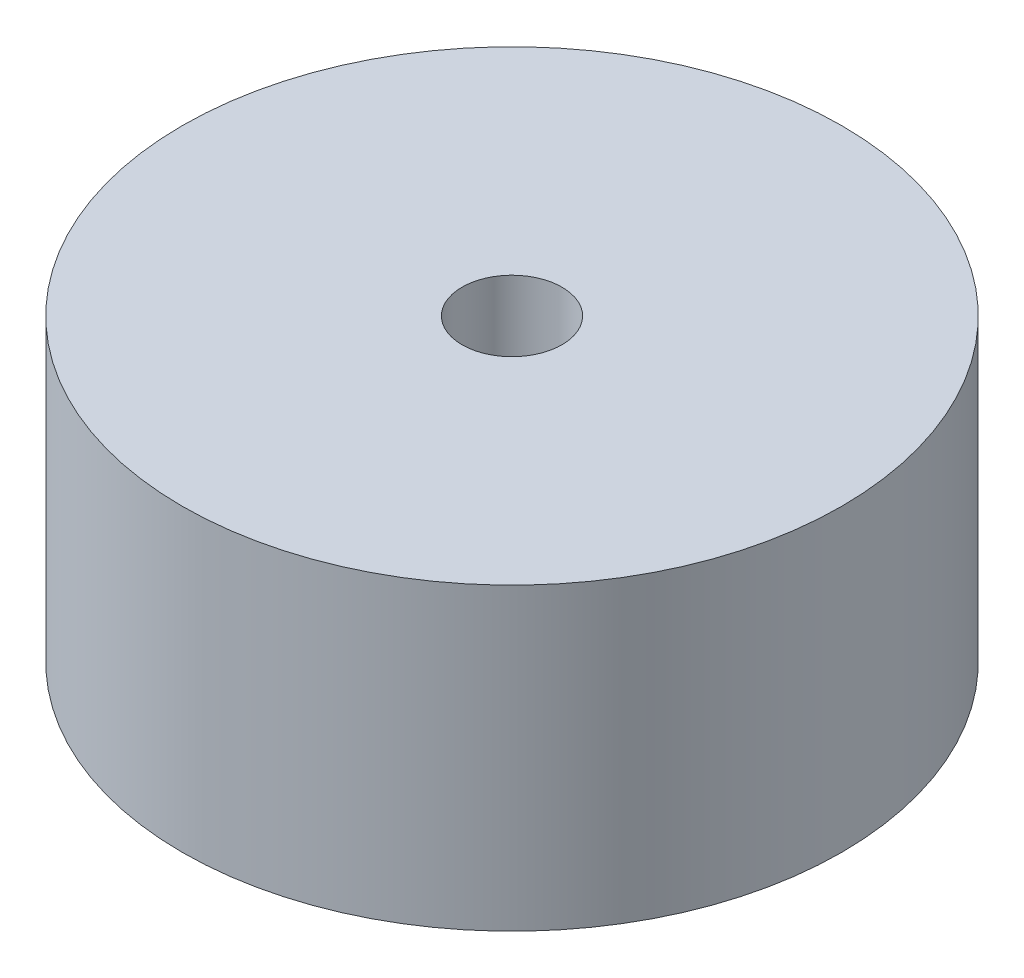
from build123d import *

# Parameters (mm, degrees)
SKETCH1_R           = 33
SKETCH1_R_2         = 5
BOSS_EXTRUDE1_DEPTH = 30


with BuildPart() as part:
    # Sketch1 → Boss-Extrude1 (new body)
    with BuildSketch(Plane(origin=(0, 0, 0), x_dir=(1, 0, 0), z_dir=(0, 1, 0))):
        with Locations(Location((0, 0, 0), (0, 0, 270))):
            Circle(SKETCH1_R)
        with Locations(Location((0, 0, 0), (0, 0, 270))):
            Circle(SKETCH1_R_2, mode=Mode.SUBTRACT)
    extrude(amount=BOSS_EXTRUDE1_DEPTH)


solid = part.part
